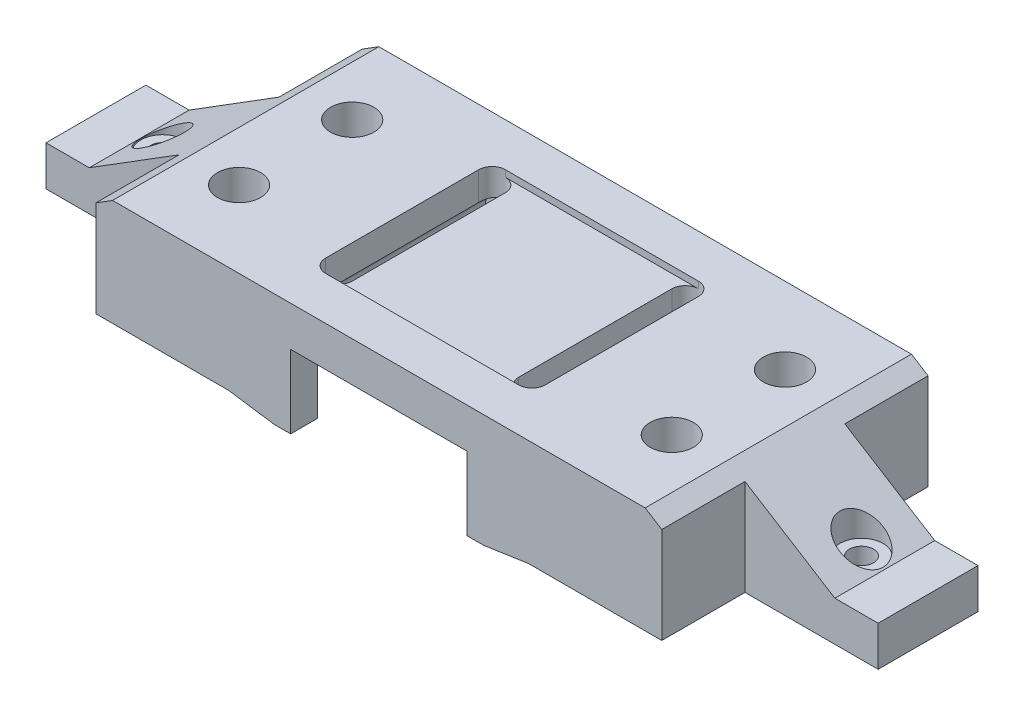
from build123d import *
from build123d.topology import SkipClean

# Parameters (mm, degrees)
SKETCH1_R                      = 1.8
BOSS_EXTRUDE1_DEPTH            = 6
BOSS_EXTRUDE2_REACH            = 76.446
CUT_EXTRUDE1_REACH             = 68.38
SKETCH3_R                      = 1.8
SKETCH3_W                      = 13.5
SKETCH3_H                      = 12.5
SKETCH4_R                      = 3.25
CUT_EXTRUDE2_DEPTH             = 10
CUT_EXTRUDE3_REACH             = 77.909
CUT_EXTRUDE4_START             = -2
SKETCH6_W                      = 35
SKETCH6_H                      = 27
CUT_EXTRUDE4_DEPTH             = 4.307692
FILLET1_R                      = 2
BOSS_EXTRUDE3_DEPTH            = 4
CUT_EXTRUDE5_REACH             = 68.897
CUT_EXTRUDE5_DIRECTION_2_REACH = 68.897
SKETCH9_W                      = 9.25
SKETCH9_H                      = 10
CUT_EXTRUDE6_DEPTH             = 32
SKETCH10_W                     = 29
SKETCH10_H                     = 27
CUT_EXTRUDE7_DEPTH             = 1


with BuildPart() as part:
    # Sketch1 → Boss-Extrude1 (new body)
    with BuildSketch(Plane(origin=(0, 0, 0), x_dir=(1, 0, 0), z_dir=(0, 1, 0))):
        Polygon((42.5, 20), (42.5, 7.5), (62.5, 7.5), (62.5, -7.5), (42.5, -7.5), (42.5, -20), (-42.5, -20), (-42.5, -7.5), (-62.5, -7.5), (-62.5, 7.5), (-42.5, 7.5), (-42.5, 20), align=None)
        with Locations(Location((-52.5, 0, 0), (0, 0, 270))):
            Circle(SKETCH1_R, mode=Mode.SUBTRACT)
        with Locations(Location((-32.5, 8.5, 0), (0, 0, 270))):
            Circle(SKETCH1_R, mode=Mode.SUBTRACT)
        with Locations(Location((-32.5, -8.5, 0), (0, 0, 270))):
            Circle(SKETCH1_R, mode=Mode.SUBTRACT)
        with Locations(Location((32.5, -8.5, 0), (0, 0, 90))):
            Circle(SKETCH1_R, mode=Mode.SUBTRACT)
        with Locations(Location((52.5, 0, 0), (0, 0, 90))):
            Circle(SKETCH1_R, mode=Mode.SUBTRACT)
        with Locations(Location((32.5, 8.5, 0), (0, 0, 90))):
            Circle(SKETCH1_R, mode=Mode.SUBTRACT)
    extrude(amount=BOSS_EXTRUDE1_DEPTH)

    # Boss-Extrude2: up to this face of the body (flat: up to its plane)
    boss_extrude2_end = Plane(part.part.faces().sort_by_distance((0, 3, 20))[0])
    # Sketch2 → Boss-Extrude2 (add, up to the picked face)
    with BuildSketch(Plane(origin=(0, 0, -20), x_dir=(-1, 0, 0), z_dir=(0, 0, -1)), mode=Mode.PRIVATE) as boss_extrude2_sk1:
        Polygon((-56, 6), (-40, 16), (40, 16), (56, 6), align=None)
    boss_extrude2_tool1 = split(extrude(boss_extrude2_sk1.sketch, amount=-BOSS_EXTRUDE2_REACH, mode=Mode.PRIVATE), bisect_by=boss_extrude2_end, keep=Keep.BOTH, mode=Mode.PRIVATE)
    add(boss_extrude2_tool1.solids().sort_by(Axis((0, 10.722222, -20), (0, 0, 1)))[0])

    # Sketch3 → Cut-Extrude1 (cut, up to next)
    with BuildSketch(Plane.XZ.offset(-6), mode=Mode.PRIVATE) as cut_extrude1_sk1:
        with Locations(Location((52.5, 0, 0), (0, 0, 270))):
            Circle(SKETCH3_R)
    cut_extrude1_tool1 = extrude(cut_extrude1_sk1.sketch, amount=-CUT_EXTRUDE1_REACH, mode=Mode.PRIVATE) & part.part
    # Sketch3 → Cut-Extrude1 (cut, up to next)
    with BuildSketch(Plane.XZ.offset(-6), mode=Mode.PRIVATE) as cut_extrude1_sk2:
        with Locations(Location((32.5, -8.5, 0), (0, 0, 270))):
            Circle(SKETCH3_R)
    cut_extrude1_tool2 = extrude(cut_extrude1_sk2.sketch, amount=-CUT_EXTRUDE1_REACH, mode=Mode.PRIVATE) & part.part
    # Sketch3 → Cut-Extrude1 (cut, up to next)
    with BuildSketch(Plane.XZ.offset(-6), mode=Mode.PRIVATE) as cut_extrude1_sk3:
        with Locations(Location((32.5, 8.5, 0), (0, 0, 270))):
            Circle(SKETCH3_R)
    cut_extrude1_tool3 = extrude(cut_extrude1_sk3.sketch, amount=-CUT_EXTRUDE1_REACH, mode=Mode.PRIVATE) & part.part
    # Sketch3 → Cut-Extrude1 (cut, up to next)
    with BuildSketch(Plane.XZ.offset(-6), mode=Mode.PRIVATE) as cut_extrude1_sk4:
        with Locations(Location((-32.5, -8.5, 0), (0, 0, 90))):
            Circle(SKETCH3_R)
    cut_extrude1_tool4 = extrude(cut_extrude1_sk4.sketch, amount=-CUT_EXTRUDE1_REACH, mode=Mode.PRIVATE) & part.part
    # Sketch3 → Cut-Extrude1 (cut, up to next)
    with BuildSketch(Plane.XZ.offset(-6), mode=Mode.PRIVATE) as cut_extrude1_sk5:
        with Locations(Location((-52.5, 0, 0), (0, 0, 180))):
            Circle(SKETCH3_R)
    cut_extrude1_tool5 = extrude(cut_extrude1_sk5.sketch, amount=-CUT_EXTRUDE1_REACH, mode=Mode.PRIVATE) & part.part
    # Sketch3 → Cut-Extrude1 (cut, up to next)
    with BuildSketch(Plane.XZ.offset(-6), mode=Mode.PRIVATE) as cut_extrude1_sk6:
        with Locations(Location((-32.5, 8.5, 0), (0, 0, 90))):
            Circle(SKETCH3_R)
    cut_extrude1_tool6 = extrude(cut_extrude1_sk6.sketch, amount=-CUT_EXTRUDE1_REACH, mode=Mode.PRIVATE) & part.part
    # Sketch3 → Cut-Extrude1 (cut, up to next)
    with BuildSketch(Plane.XZ.offset(-6), mode=Mode.PRIVATE) as cut_extrude1_sk7:
        with Locations((-49.25, 13.75)):
            Rectangle(SKETCH3_W, SKETCH3_H)
    cut_extrude1_tool7 = extrude(cut_extrude1_sk7.sketch, amount=-CUT_EXTRUDE1_REACH, mode=Mode.PRIVATE) & part.part
    # Sketch3 → Cut-Extrude1 (cut, up to next)
    with BuildSketch(Plane.XZ.offset(-6), mode=Mode.PRIVATE) as cut_extrude1_sk8:
        with Locations((-49.25, -13.75)):
            Rectangle(SKETCH3_W, SKETCH3_H)
    cut_extrude1_tool8 = extrude(cut_extrude1_sk8.sketch, amount=-CUT_EXTRUDE1_REACH, mode=Mode.PRIVATE) & part.part
    # Sketch3 → Cut-Extrude1 (cut, up to next)
    with BuildSketch(Plane.XZ.offset(-6), mode=Mode.PRIVATE) as cut_extrude1_sk9:
        with Locations((49.25, -13.75)):
            Rectangle(SKETCH3_W, SKETCH3_H)
    cut_extrude1_tool9 = extrude(cut_extrude1_sk9.sketch, amount=-CUT_EXTRUDE1_REACH, mode=Mode.PRIVATE) & part.part
    # Sketch3 → Cut-Extrude1 (cut, up to next)
    with BuildSketch(Plane.XZ.offset(-6), mode=Mode.PRIVATE) as cut_extrude1_sk10:
        with Locations((49.25, 13.75)):
            Rectangle(SKETCH3_W, SKETCH3_H)
    cut_extrude1_tool10 = extrude(cut_extrude1_sk10.sketch, amount=-CUT_EXTRUDE1_REACH, mode=Mode.PRIVATE) & part.part
    add(cut_extrude1_tool1.solids().sort_by_distance((52.5, 6, 0))[0], mode=Mode.SUBTRACT)
    add(cut_extrude1_tool2.solids().sort_by_distance((32.5, 6, -8.5))[0], mode=Mode.SUBTRACT)
    add(cut_extrude1_tool3.solids().sort_by_distance((32.5, 6, 8.5))[0], mode=Mode.SUBTRACT)
    add(cut_extrude1_tool4.solids().sort_by_distance((-32.5, 6, -8.5))[0], mode=Mode.SUBTRACT)
    add(cut_extrude1_tool5.solids().sort_by_distance((-52.5, 6, 0))[0], mode=Mode.SUBTRACT)
    add(cut_extrude1_tool6.solids().sort_by_distance((-32.5, 6, 8.5))[0], mode=Mode.SUBTRACT)
    add(cut_extrude1_tool7.solids().sort_by_distance((-49.25, 6, 13.75))[0], mode=Mode.SUBTRACT)
    add(cut_extrude1_tool8.solids().sort_by_distance((-49.25, 6, -13.75))[0], mode=Mode.SUBTRACT)
    add(cut_extrude1_tool9.solids().sort_by_distance((49.25, 6, -13.75))[0], mode=Mode.SUBTRACT)
    add(cut_extrude1_tool10.solids().sort_by_distance((49.25, 6, 13.75))[0], mode=Mode.SUBTRACT)

    # Sketch4 → Cut-Extrude2 (cut)
    with BuildSketch(Plane(origin=(0, 16, 0), x_dir=(1, 0, 0), z_dir=(0, 1, 0))):
        with Locations(Location((-32.5, 8.5, 0), (0, 0, 270))):
            Circle(SKETCH4_R)
        with Locations(Location((-52.5, 0, 0), (0, 0, 270))):
            Circle(SKETCH4_R)
        with Locations(Location((-32.5, -8.5, 0), (0, 0, 270))):
            Circle(SKETCH4_R)
        with Locations(Location((32.5, 8.5, 0), (0, 0, 270))):
            Circle(SKETCH4_R)
        with Locations(Location((32.5, -8.5, 0), (0, 0, 270))):
            Circle(SKETCH4_R)
        with Locations(Location((52.5, 0, 0), (0, 0, 270))):
            Circle(SKETCH4_R)
    extrude(amount=-CUT_EXTRUDE2_DEPTH, mode=Mode.SUBTRACT)

    # Sketch5 → Cut-Extrude3 (cut, up to next)
    with BuildSketch(Plane(origin=(0, 0, -20), x_dir=(-1, 0, 0), z_dir=(0, 0, -1)), mode=Mode.PRIVATE) as cut_extrude3_sk1:
        Polygon((-22.5, 0), (-16, 10), (16, 10), (22.5, 0), align=None)
    cut_extrude3_tool1 = extrude(cut_extrude3_sk1.sketch, amount=-CUT_EXTRUDE3_REACH, mode=Mode.PRIVATE) & part.part
    add(cut_extrude3_tool1.solids().sort_by_distance((0, 4.718615, -20))[0], mode=Mode.SUBTRACT)

    # Sketch6 → Cut-Extrude4 (cut)
    with BuildSketch(Plane.XZ.offset(-10).offset(CUT_EXTRUDE4_START)):
        Rectangle(SKETCH6_W, SKETCH6_H)
    extrude(amount=CUT_EXTRUDE4_DEPTH, mode=Mode.SUBTRACT)

    # Fillet1
    fillet1_edges = [part.edges().sort_by_distance(p)[0] for p in [
        (-17.5, 12, 0),
        (17.5, 12, 0),
    ]]
    fillet(fillet1_edges, radius=FILLET1_R)

    # Sketch7 → Boss-Extrude3 (add)
    with BuildSketch(Plane(origin=(0, 0, -20), x_dir=(-1, 0, 0), z_dir=(0, 0, -1))):
        Polygon((-22.5, 0), (-15.75, -1), (-13.25, -1), (-13.25, 10), (-16, 10), align=None)
        Polygon((16, 10), (22.5, 0), (15.75, -1), (13.25, -1), (13.25, 10), align=None)
    boss_extrude3 = extrude(amount=-BOSS_EXTRUDE3_DEPTH)

    # Mirror1: Boss-Extrude3 across plane
    add(boss_extrude3.mirror(Plane.XY))

    # Sketch8 → Cut-Extrude5 (cut, up to next)
    with BuildSketch(Plane.XZ.offset(-12), mode=Mode.PRIVATE) as cut_extrude5_sk1:
        with BuildLine():
            Line((-12.5, 11.5), (-12.5, -11.5))
            ThreePointArc((-12.5, -11.5), (-14.5, -13.5), (-16.5, -11.5))
            Line((-16.5, -11.5), (-16.5, 11.5))
            ThreePointArc((-16.5, 11.5), (-14.5, 13.5), (-12.5, 11.5))
        make_face()
    cut_extrude5_tool1 = extrude(cut_extrude5_sk1.sketch, amount=-CUT_EXTRUDE5_REACH, mode=Mode.PRIVATE) & part.part
    # Sketch8 → Cut-Extrude5 (cut, up to next)
    with BuildSketch(Plane.XZ.offset(-12), mode=Mode.PRIVATE) as cut_extrude5_sk2:
        with BuildLine():
            Line((16.5, 11.5), (16.5, -11.5))
            ThreePointArc((16.5, -11.5), (14.5, -13.5), (12.5, -11.5))
            Line((12.5, -11.5), (12.5, 11.5))
            ThreePointArc((12.5, 11.5), (14.5, 13.5), (16.5, 11.5))
        make_face()
    cut_extrude5_tool2 = extrude(cut_extrude5_sk2.sketch, amount=-CUT_EXTRUDE5_REACH, mode=Mode.PRIVATE) & part.part
    add(cut_extrude5_tool1.solids().sort_by_distance((-14.5, 12, 0))[0], mode=Mode.SUBTRACT)
    add(cut_extrude5_tool2.solids().sort_by_distance((14.5, 12, 0))[0], mode=Mode.SUBTRACT)

    # Sketch8 → Cut-Extrude5 direction 2 (cut, up to next)
    with BuildSketch(Plane.XZ.offset(-12), mode=Mode.PRIVATE) as cut_extrude5_direction_2_sk1:
        with BuildLine():
            Line((-12.5, 11.5), (-12.5, -11.5))
            ThreePointArc((-12.5, -11.5), (-14.5, -13.5), (-16.5, -11.5))
            Line((-16.5, -11.5), (-16.5, 11.5))
            ThreePointArc((-16.5, 11.5), (-14.5, 13.5), (-12.5, 11.5))
        make_face()
    cut_extrude5_direction_2_tool1 = extrude(cut_extrude5_direction_2_sk1.sketch, amount=CUT_EXTRUDE5_DIRECTION_2_REACH, mode=Mode.PRIVATE) & part.part
    # Sketch8 → Cut-Extrude5 direction 2 (cut, up to next)
    with BuildSketch(Plane.XZ.offset(-12), mode=Mode.PRIVATE) as cut_extrude5_direction_2_sk2:
        with BuildLine():
            Line((16.5, 11.5), (16.5, -11.5))
            ThreePointArc((16.5, -11.5), (14.5, -13.5), (12.5, -11.5))
            Line((12.5, -11.5), (12.5, 11.5))
            ThreePointArc((12.5, 11.5), (14.5, 13.5), (16.5, 11.5))
        make_face()
    cut_extrude5_direction_2_tool2 = extrude(cut_extrude5_direction_2_sk2.sketch, amount=CUT_EXTRUDE5_DIRECTION_2_REACH, mode=Mode.PRIVATE) & part.part
    add(cut_extrude5_direction_2_tool1.solids().sort_by_distance((-14.5, 12, 0))[0], mode=Mode.SUBTRACT)
    add(cut_extrude5_direction_2_tool2.solids().sort_by_distance((14.5, 12, 0))[0], mode=Mode.SUBTRACT)

    # Sketch9 → Cut-Extrude6 (cut)
    with BuildSketch(Plane(origin=(0, 0, 16), x_dir=(-1, 0, 0), z_dir=(0, 0, -1))):
        with Locations((-17.875, 5)):
            Rectangle(SKETCH9_W, SKETCH9_H)
    extrude(amount=CUT_EXTRUDE6_DEPTH, mode=Mode.SUBTRACT)

    # Sketch10 → Cut-Extrude7 (cut)
    with BuildSketch(Plane(origin=(0, 16, 0), x_dir=(1, 0, 0), z_dir=(0, 1, 0))):
        Rectangle(SKETCH10_W, SKETCH10_H)
    extrude(amount=-CUT_EXTRUDE7_DEPTH, mode=Mode.SUBTRACT)


solid = part.part
